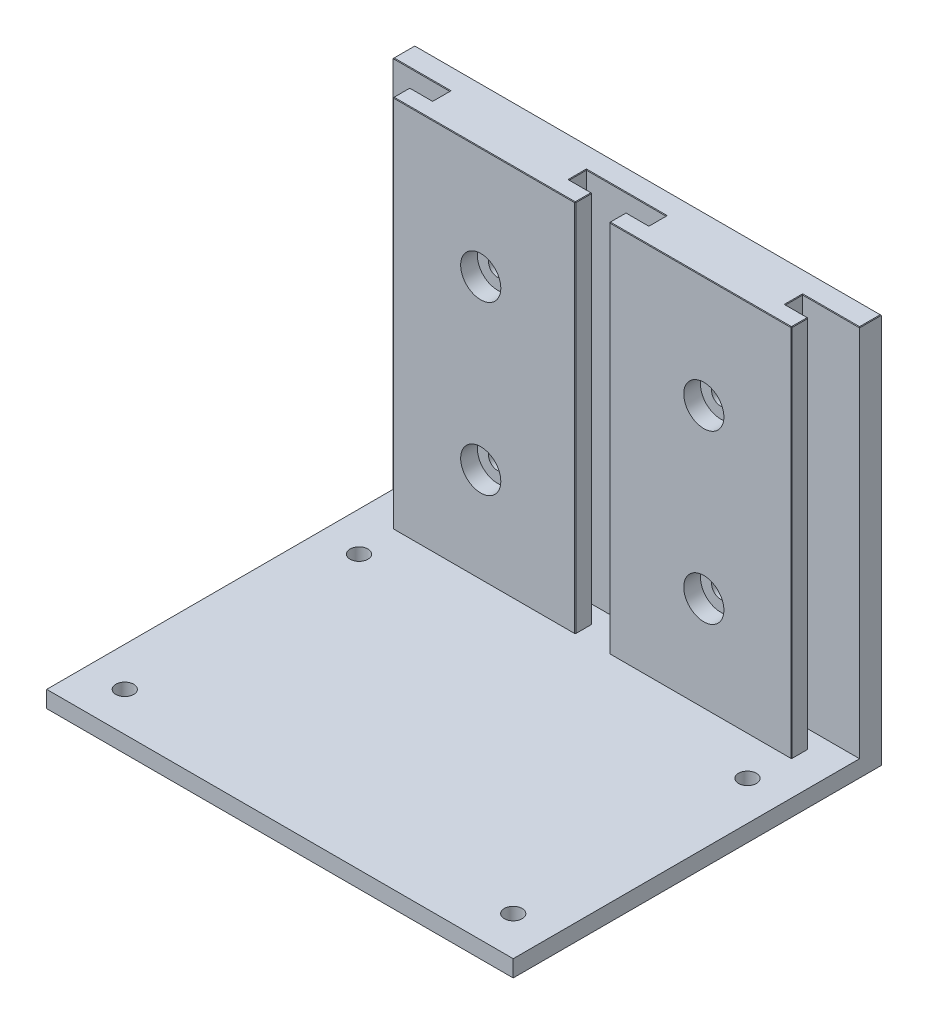
from build123d import *

# Parameters (mm, degrees)
SKETCH1_W           = 83.65
SKETCH1_H           = 56
SKETCH1_R           = 1.6
BOSS_EXTRUDE1_DEPTH = 3
SKETCH2_W           = 83.65
SKETCH2_H           = 10
BOSS_EXTRUDE2_DEPTH = 70
SKETCH3_W           = 4.1
SKETCH3_H           = 3.1
CUT_EXTRUDE1_DEPTH  = 67
CHAMFER1_SIZE       = 0.1
CHAMFER2_SIZE       = 0.1
SKETCH4_R           = 1.6
CUT_EXTRUDE2_DEPTH  = 10
CUT_EXTRUDE3_START  = -3
SKETCH5_R           = 3.6
SKETCH5_R_2         = 1.6
CUT_EXTRUDE3_DEPTH  = 3


with BuildPart() as part:
    # Sketch1 → Boss-Extrude1 (new body)
    with BuildSketch(Plane(origin=(0, 0, 0), x_dir=(1, 0, 0), z_dir=(0, 1, 0))):
        Rectangle(SKETCH1_W, SKETCH1_H)
        with Locations(Location((-34.825, -21, 0), (0, 0, 270))):
            Circle(SKETCH1_R, mode=Mode.SUBTRACT)
        with Locations(Location((34.825, -21, 0), (0, 0, 270))):
            Circle(SKETCH1_R, mode=Mode.SUBTRACT)
        with Locations(Location((34.825, 21, 0), (0, 0, 270))):
            Circle(SKETCH1_R, mode=Mode.SUBTRACT)
        with Locations(Location((-34.825, 21, 0), (0, 0, 270))):
            Circle(SKETCH1_R, mode=Mode.SUBTRACT)
    extrude(amount=BOSS_EXTRUDE1_DEPTH)

    # Sketch2 → Boss-Extrude2 (add)
    with BuildSketch(Plane(origin=(0, 0, 0), x_dir=(1, 0, 0), z_dir=(0, 1, 0))):
        with Locations((0, 33)):
            Rectangle(SKETCH2_W, SKETCH2_H)
    extrude(amount=BOSS_EXTRUDE2_DEPTH)

    # Sketch3 → Cut-Extrude1 (cut)
    with BuildSketch(Plane(origin=(0, 70, 0), x_dir=(1, 0, 0), z_dir=(0, 1, 0))):
        Polygon((-3.05, 31), (-3.05, 28), (3.05, 28), (3.05, 31), (3.05, 34.1), (-3.05, 34.1), align=None)
        with Locations((-5.1, 32.55)):
            Rectangle(SKETCH3_W, SKETCH3_H)
        with Locations((5.1, 32.55)):
            Rectangle(SKETCH3_W, SKETCH3_H)
        with Locations((33.675, 32.55)):
            Rectangle(SKETCH3_W, SKETCH3_H)
        Polygon((35.725, 31), (35.725, 28), (41.825, 28), (41.825, 34.1), (35.725, 34.1), align=None)
        with Locations((-33.675, 32.55)):
            Rectangle(SKETCH3_W, SKETCH3_H)
        Polygon((-35.725, 31), (-35.725, 34.1), (-41.825, 34.1), (-41.825, 28), (-35.725, 28), align=None)
    extrude(amount=-CUT_EXTRUDE1_DEPTH, mode=Mode.SUBTRACT)

    # Chamfer1
    chamfer1_edges = [part.edges().sort_by_distance(p)[0] for p in [
        (3.05, 36.5, -31),
        (3.05, 36.5, -28),
        (-3.05, 36.5, -28),
        (-3.05, 36.5, -31),
        (35.725, 36.5, -28),
        (35.725, 36.5, -31),
        (-35.725, 36.5, -28),
        (-35.725, 36.5, -31),
    ]]
    chamfer(chamfer1_edges, length=CHAMFER1_SIZE)

    # Chamfer2
    chamfer2_edges = [part.edges().sort_by_distance(p)[0] for p in [
        (-35.725, 70, -29.5),
        (19.3875, 70, -28),
        (35.725, 70, -29.5),
        (-19.3875, 70, -28),
        (-3.05, 70, -29.5),
        (-5.15, 70, -31),
        (5.15, 70, -31),
        (3.05, 70, -29.5),
        (-3.1, 70, -28.05),
        (-3.1, 70, -30.95),
        (35.675, 70, -28.05),
        (35.675, 70, -30.95),
        (3.1, 70, -28.05),
        (3.1, 70, -30.95),
        (-35.675, 70, -30.95),
        (-35.675, 70, -28.05),
        (-41.825, 70, -36.05),
        (0, 70, -38),
        (-7.15, 70, -32.55),
        (0, 70, -34.1),
        (7.15, 70, -32.55),
        (41.825, 70, -36.05),
        (33.625, 70, -31),
        (36.725, 70, -34.1),
        (31.625, 70, -32.55),
        (-31.625, 70, -32.55),
        (-36.725, 70, -34.1),
        (-33.625, 70, -31),
    ]]
    chamfer(chamfer2_edges, length=CHAMFER2_SIZE)

    # Sketch4 → Cut-Extrude2 (cut)
    with BuildSketch(Plane(origin=(0, 0, -38), x_dir=(-1, 0, 0), z_dir=(0, 0, -1))):
        with Locations((-20, 20)):
            Circle(SKETCH4_R)
        with Locations((-20, 50)):
            Circle(SKETCH4_R)
        with Locations((20, 20)):
            Circle(SKETCH4_R)
        with Locations((20, 50)):
            Circle(SKETCH4_R)
    extrude(amount=-CUT_EXTRUDE2_DEPTH, mode=Mode.SUBTRACT)

    # Sketch5 → Cut-Extrude3 (cut)
    # profile 1 of 4: a face of its own
    with BuildSketch(Plane.XY.offset(-28).offset(CUT_EXTRUDE3_START)):
        with Locations((-20, 20)):
            Circle(SKETCH5_R)
        with Locations((-20, 20)):
            Circle(SKETCH5_R_2, mode=Mode.SUBTRACT)
    # profile 2 of 4: a face of its own
    with BuildSketch(Plane.XY.offset(-28).offset(CUT_EXTRUDE3_START)):
        with Locations((20, 20)):
            Circle(SKETCH5_R)
    # profile 3 of 4: a face of its own
    with BuildSketch(Plane.XY.offset(-28).offset(CUT_EXTRUDE3_START)):
        with Locations((20, 50)):
            Circle(SKETCH5_R)
    # profile 4 of 4: a face of its own
    with BuildSketch(Plane.XY.offset(-28).offset(CUT_EXTRUDE3_START)):
        with Locations((-20, 50)):
            Circle(SKETCH5_R)
    extrude(amount=CUT_EXTRUDE3_DEPTH, mode=Mode.SUBTRACT)


solid = part.part
